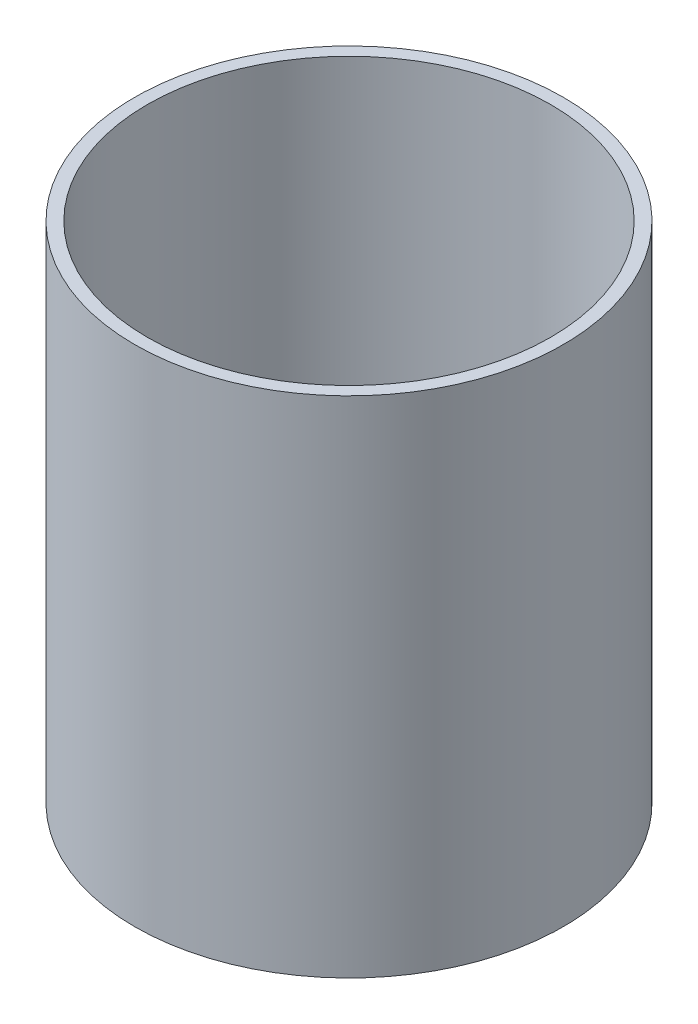
from build123d import *

# Parameters (mm, degrees)
SKETCH1_R           = 107.95
SKETCH1_R_2         = 101.6
BOSS_EXTRUDE1_DEPTH = 254


with BuildPart() as part:
    # Sketch1 → Boss-Extrude1 (new body)
    with BuildSketch(Plane(origin=(0, 0, 0), x_dir=(1, 0, 0), z_dir=(0, 1, 0))):
        with Locations(Location((0, 0, 0), (0, 0, 270))):
            Circle(SKETCH1_R)
        with Locations(Location((0, 0, 0), (0, 0, 270))):
            Circle(SKETCH1_R_2, mode=Mode.SUBTRACT)
    extrude(amount=BOSS_EXTRUDE1_DEPTH)


solid = part.part
